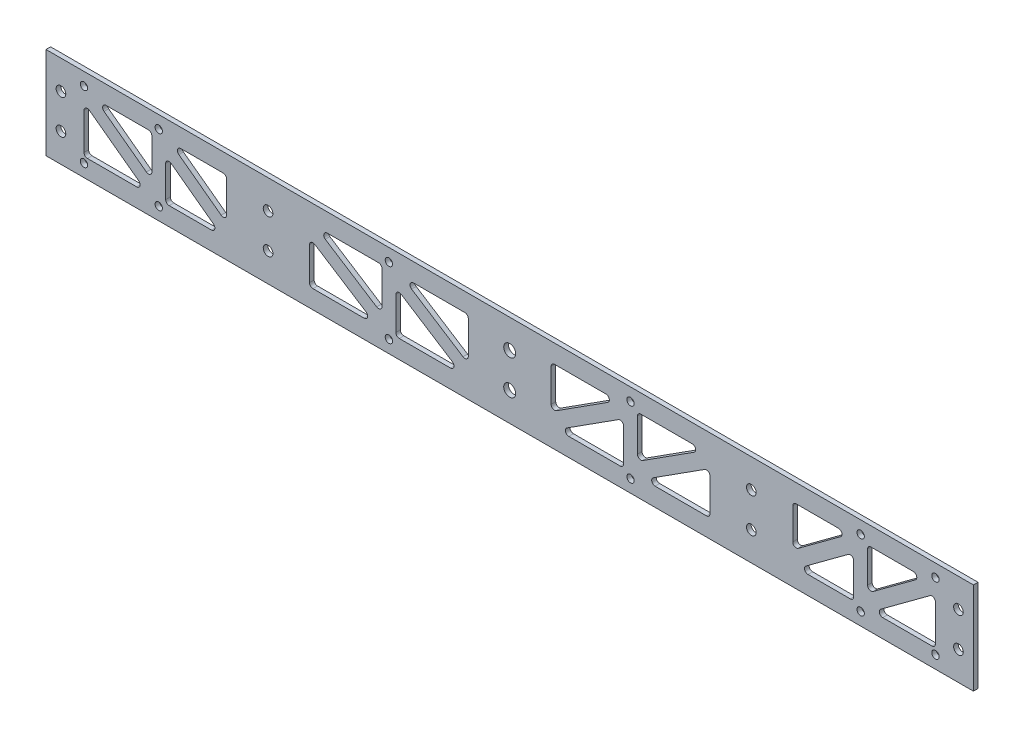
from build123d import *

# Parameters (mm, degrees)
SKETCH_1_W          = 403
SKETCH_1_H          = 40
EXTRUDE_1_DEPTH     = 2
CUT_EXTRUDE_1_DEPTH = 203.5
FILLET_1_R          = 1.5
SKETCH_3_R          = 2.1
SKETCH_3_R_2        = 1.6
SKETCH_3_R_3        = 2.6
CUT_EXTRUDE_2_DEPTH = 203.5


with BuildPart() as part:
    # 草图1 → 凸台-拉伸1 (new body)
    with BuildSketch(Plane.XY):
        Rectangle(SKETCH_1_W, SKETCH_1_H)
    extrude(amount=EXTRUDE_1_DEPTH)

    # 草图2 → 切除-拉伸1 (cut, through all)
    with BuildSketch(Plane.XY.offset(2)):
        Polygon((-157.550139231, -12), (-185, 8.270666414), (-185, -12), align=None)
        Polygon((-179.949860769, 12), (-155.5, -6.055281799), (-155.5, 12), align=None)
        Polygon((-149.5, 6.055281799), (-149.5, -12), (-125.050139231, -12), align=None)
        Polygon((-147.449860769, 12), (-123, -6.055281799), (-123, 12), align=None)
        Polygon((-87, 6.518202701), (-87, -12), (-58.06530828, -12), align=None)
        Polygon((-84.43469172, 12), (-55.5, -6.518202701), (-55.5, 12), align=None)
        Polygon((-46.93469172, 12), (-18, -6.518202701), (-18, 12), align=None)
        Polygon((-49.5, 6.518202701), (-49.5, -12), (-20.56530828, -12), align=None)
        Polygon((46.93469172, 12), (18, 12), (18, -6.518202701), align=None)
        Polygon((49.5, -12), (49.5, 6.518202701), (20.56530828, -12), align=None)
        Polygon((84.43469172, 12), (55.5, 12), (55.5, -6.518202701), align=None)
        Polygon((87, 6.518202701), (58.06530828, -12), (87, -12), align=None)
        Polygon((123, 12), (123, -6.055281799), (147.449860769, 12), align=None)
        Polygon((149.5, 6.055281799), (125.050139231, -12), (149.5, -12), align=None)
        Polygon((155.5, 12), (155.5, -6.055281799), (179.949860769, 12), align=None)
        Polygon((185, 8.270666414), (157.550139231, -12), (185, -12), align=None)
    extrude(amount=-CUT_EXTRUDE_1_DEPTH, mode=Mode.SUBTRACT)

    # 圆角1
    fillet_1_edges = [part.edges().sort_by_distance(p)[0] for p in [
        (-87, 6.518202701, 1),
        (-58.06530828, -12, 1),
        (-87, -12, 1),
        (149.5, 6.055281799, 1),
        (149.5, -12, 1),
        (125.050139231, -12, 1),
        (155.5, 12, 1),
        (179.949860769, 12, 1),
        (155.5, -6.055281799, 1),
        (185, 8.270666414, 1),
        (185, -12, 1),
        (157.550139231, -12, 1),
        (49.5, -12, 1),
        (20.56530828, -12, 1),
        (49.5, 6.518202701, 1),
        (84.43469172, 12, 1),
        (55.5, -6.518202701, 1),
        (55.5, 12, 1),
        (87, 6.518202701, 1),
        (87, -12, 1),
        (58.06530828, -12, 1),
        (123, 12, 1),
        (147.449860769, 12, 1),
        (123, -6.055281799, 1),
        (-157.550139231, -12, 1),
        (-185, -12, 1),
        (-185, 8.270666414, 1),
        (-84.43469172, 12, 1),
        (-55.5, 12, 1),
        (-55.5, -6.518202701, 1),
        (-46.93469172, 12, 1),
        (-18, 12, 1),
        (-18, -6.518202701, 1),
        (-49.5, 6.518202701, 1),
        (-20.56530828, -12, 1),
        (-49.5, -12, 1),
        (46.93469172, 12, 1),
        (18, -6.518202701, 1),
        (18, 12, 1),
        (-179.949860769, 12, 1),
        (-155.5, 12, 1),
        (-155.5, -6.055281799, 1),
        (-149.5, 6.055281799, 1),
        (-125.050139231, -12, 1),
        (-149.5, -12, 1),
        (-147.449860769, 12, 1),
        (-123, 12, 1),
        (-123, -6.055281799, 1),
    ]]
    fillet(fillet_1_edges, radius=FILLET_1_R)

    # 草图3 → 切除-拉伸2 (cut, through all)
    with BuildSketch(Plane(origin=(0, 0, 0), x_dir=(-1, 0, 0), z_dir=(0, 0, -1))):
        with Locations((195, -7.5)):
            Circle(SKETCH_3_R)
        with Locations((-195, 7.5)):
            Circle(SKETCH_3_R)
        with Locations((195, 7.5)):
            Circle(SKETCH_3_R)
        with Locations((105, 7.5)):
            Circle(SKETCH_3_R)
        with Locations((105, -7.5)):
            Circle(SKETCH_3_R)
        with Locations((-105, 7.5)):
            Circle(SKETCH_3_R)
        with Locations((-105, -7.5)):
            Circle(SKETCH_3_R)
        with Locations((-195, -7.5)):
            Circle(SKETCH_3_R)
        with Locations((-152.5, -14.5)):
            Circle(SKETCH_3_R_2)
        with Locations((-185, 14.5)):
            Circle(SKETCH_3_R_2)
        with Locations((-185, -14.5)):
            Circle(SKETCH_3_R_2)
        with Locations((185, -14.5)):
            Circle(SKETCH_3_R_2)
        with Locations((-52.5, -14.5)):
            Circle(SKETCH_3_R_2)
        with Locations((52.5, -14.5)):
            Circle(SKETCH_3_R_2)
        with Locations((152.5, -14.5)):
            Circle(SKETCH_3_R_2)
        with Locations((152.5, 14.5)):
            Circle(SKETCH_3_R_2)
        with Locations((185, 14.5)):
            Circle(SKETCH_3_R_2)
        with Locations((-152.5, 14.5)):
            Circle(SKETCH_3_R_2)
        with Locations((-52.5, 14.5)):
            Circle(SKETCH_3_R_2)
        with Locations((52.5, 14.5)):
            Circle(SKETCH_3_R_2)
        with Locations((0, -7.5)):
            Circle(SKETCH_3_R_3)
        with Locations((0, 7.5)):
            Circle(SKETCH_3_R_3)
        with BuildLine():
            Line((-57, 12), (-79.30828758, 12))
            ThreePointArc((-79.30828758, 12), (-80.7479248, 10.921241824), (-80.116868125, 9.236592899))
            Line((-80.116868125, 9.236592899), (-57.808580545, -5.040711152))
            ThreePointArc((-57.808580545, -5.040711152), (-56.279885709, -5.093144242), (-55.5, -3.777304051))
            Line((-55.5, -3.777304051), (-55.5, 10.5))
            ThreePointArc((-55.5, 10.5), (-55.939339828, 11.560660172), (-57, 12))
        make_face()
        with BuildLine():
            Line((-49.5, 3.777304051), (-49.5, -10.5))
            ThreePointArc((-49.5, -10.5), (-49.060660172, -11.560660172), (-48, -12))
            Line((-48, -12), (-25.69171242, -12))
            ThreePointArc((-25.69171242, -12), (-24.2520752, -10.921241824), (-24.883131875, -9.236592899))
            Line((-24.883131875, -9.236592899), (-47.191419455, 5.040711152))
            ThreePointArc((-47.191419455, 5.040711152), (-48.720114291, 5.093144242), (-49.5, 3.777304051))
        make_face()
        with BuildLine():
            Line((-157, 12), (-175.393541154, 12))
            ThreePointArc((-175.393541154, 12), (-176.818317426, 10.96905498), (-176.284605696, 9.2933501))
            Line((-176.284605696, 9.2933501), (-157.891064542, -4.289572599))
            ThreePointArc((-157.891064542, -4.289572599), (-156.324202994, -4.422063619), (-155.5, -3.082922698))
            Line((-155.5, -3.082922698), (-155.5, 10.5))
            ThreePointArc((-155.5, 10.5), (-155.939339828, 11.560660172), (-157, 12))
        make_face()
        with BuildLine():
            Line((-123, -3.082922698), (-123, 10.5))
            ThreePointArc((-123, 10.5), (-123.439339828, 11.560660172), (-124.5, 12))
            Line((-124.5, 12), (-142.893541154, 12))
            ThreePointArc((-142.893541154, 12), (-144.318317426, 10.96905498), (-143.784605696, 9.2933501))
            Line((-143.784605696, 9.2933501), (-125.391064542, -4.289572599))
            ThreePointArc((-125.391064542, -4.289572599), (-123.824202994, -4.422063619), (-123, -3.082922698))
        make_face()
        with BuildLine():
            Line((149.5, -10.5), (149.5, 3.082922698))
            ThreePointArc((149.5, 3.082922698), (148.675797006, 4.422063619), (147.108935458, 4.289572599))
            Line((147.108935458, 4.289572599), (128.715394304, -9.2933501))
            ThreePointArc((128.715394304, -9.2933501), (128.181682574, -10.96905498), (129.606458846, -12))
            Line((129.606458846, -12), (148, -12))
            ThreePointArc((148, -12), (149.060660172, -11.560660172), (149.5, -10.5))
        make_face()
        with BuildLine():
            Line((175.393541154, 12), (157, 12))
            ThreePointArc((157, 12), (155.939339828, 11.560660172), (155.5, 10.5))
            Line((155.5, 10.5), (155.5, -3.082922698))
            ThreePointArc((155.5, -3.082922698), (156.324202994, -4.422063619), (157.891064542, -4.289572599))
            Line((157.891064542, -4.289572599), (176.284605696, 9.2933501))
            ThreePointArc((176.284605696, 9.2933501), (176.818317426, 10.96905498), (175.393541154, 12))
        make_face()
        with BuildLine():
            Line((87, -10.5), (87, 3.777304051))
            ThreePointArc((87, 3.777304051), (86.220114291, 5.093144242), (84.691419455, 5.040711152))
            Line((84.691419455, 5.040711152), (62.383131875, -9.236592899))
            ThreePointArc((62.383131875, -9.236592899), (61.7520752, -10.921241824), (63.19171242, -12))
            Line((63.19171242, -12), (85.5, -12))
            ThreePointArc((85.5, -12), (86.560660172, -11.560660172), (87, -10.5))
        make_face()
        with BuildLine():
            Line((142.893541154, 12), (124.5, 12))
            ThreePointArc((124.5, 12), (123.439339828, 11.560660172), (123, 10.5))
            Line((123, 10.5), (123, -3.082922698))
            ThreePointArc((123, -3.082922698), (123.824202994, -4.422063619), (125.391064542, -4.289572599))
            Line((125.391064542, -4.289572599), (143.784605696, 9.2933501))
            ThreePointArc((143.784605696, 9.2933501), (144.318317426, 10.96905498), (142.893541154, 12))
        make_face()
        with BuildLine():
            Line((-161.215394304, -9.2933501), (-182.608935458, 6.504957214))
            ThreePointArc((-182.608935458, 6.504957214), (-184.175797006, 6.637448235), (-185, 5.298307314))
            Line((-185, 5.298307314), (-185, -10.5))
            ThreePointArc((-185, -10.5), (-184.560660172, -11.560660172), (-183.5, -12))
            Line((-183.5, -12), (-162.106458846, -12))
            ThreePointArc((-162.106458846, -12), (-160.681682574, -10.96905498), (-161.215394304, -9.2933501))
        make_face()
        with BuildLine():
            Line((79.30828758, 12), (57, 12))
            ThreePointArc((57, 12), (55.939339828, 11.560660172), (55.5, 10.5))
            Line((55.5, 10.5), (55.5, -3.777304051))
            ThreePointArc((55.5, -3.777304051), (56.279885709, -5.093144242), (57.808580545, -5.040711152))
            Line((57.808580545, -5.040711152), (80.116868125, 9.236592899))
            ThreePointArc((80.116868125, 9.236592899), (80.7479248, 10.921241824), (79.30828758, 12))
        make_face()
        with BuildLine():
            Line((41.80828758, 12), (19.5, 12))
            ThreePointArc((19.5, 12), (18.439339828, 11.560660172), (18, 10.5))
            Line((18, 10.5), (18, -3.777304051))
            ThreePointArc((18, -3.777304051), (18.779885709, -5.093144242), (20.308580545, -5.040711152))
            Line((20.308580545, -5.040711152), (42.616868125, 9.236592899))
            ThreePointArc((42.616868125, 9.236592899), (43.2479248, 10.921241824), (41.80828758, 12))
        make_face()
        with BuildLine():
            Line((182.608935458, 6.504957214), (161.215394304, -9.2933501))
            ThreePointArc((161.215394304, -9.2933501), (160.681682574, -10.96905498), (162.106458846, -12))
            Line((162.106458846, -12), (183.5, -12))
            ThreePointArc((183.5, -12), (184.560660172, -11.560660172), (185, -10.5))
            Line((185, -10.5), (185, 5.298307314))
            ThreePointArc((185, 5.298307314), (184.175797006, 6.637448235), (182.608935458, 6.504957214))
        make_face()
        with BuildLine():
            Line((-62.383131875, -9.236592899), (-84.691419455, 5.040711152))
            ThreePointArc((-84.691419455, 5.040711152), (-86.220114291, 5.093144242), (-87, 3.777304051))
            Line((-87, 3.777304051), (-87, -10.5))
            ThreePointArc((-87, -10.5), (-86.560660172, -11.560660172), (-85.5, -12))
            Line((-85.5, -12), (-63.19171242, -12))
            ThreePointArc((-63.19171242, -12), (-61.7520752, -10.921241824), (-62.383131875, -9.236592899))
        make_face()
        with BuildLine():
            Line((-128.715394304, -9.2933501), (-147.108935458, 4.289572599))
            ThreePointArc((-147.108935458, 4.289572599), (-148.675797006, 4.422063619), (-149.5, 3.082922698))
            Line((-149.5, 3.082922698), (-149.5, -10.5))
            ThreePointArc((-149.5, -10.5), (-149.060660172, -11.560660172), (-148, -12))
            Line((-148, -12), (-129.606458846, -12))
            ThreePointArc((-129.606458846, -12), (-128.181682574, -10.96905498), (-128.715394304, -9.2933501))
        make_face()
        with BuildLine():
            Line((-19.5, 12), (-41.80828758, 12))
            ThreePointArc((-41.80828758, 12), (-43.2479248, 10.921241824), (-42.616868125, 9.236592899))
            Line((-42.616868125, 9.236592899), (-20.308580545, -5.040711152))
            ThreePointArc((-20.308580545, -5.040711152), (-18.779885709, -5.093144242), (-18, -3.777304051))
            Line((-18, -3.777304051), (-18, 10.5))
            ThreePointArc((-18, 10.5), (-18.439339828, 11.560660172), (-19.5, 12))
        make_face()
        with BuildLine():
            Line((49.5, -10.5), (49.5, 3.777304051))
            ThreePointArc((49.5, 3.777304051), (48.720114291, 5.093144242), (47.191419455, 5.040711152))
            Line((47.191419455, 5.040711152), (24.883131875, -9.236592899))
            ThreePointArc((24.883131875, -9.236592899), (24.2520752, -10.921241824), (25.69171242, -12))
            Line((25.69171242, -12), (48, -12))
            ThreePointArc((48, -12), (49.060660172, -11.560660172), (49.5, -10.5))
        make_face()
    extrude(amount=-CUT_EXTRUDE_2_DEPTH, mode=Mode.SUBTRACT)


solid = part.part
